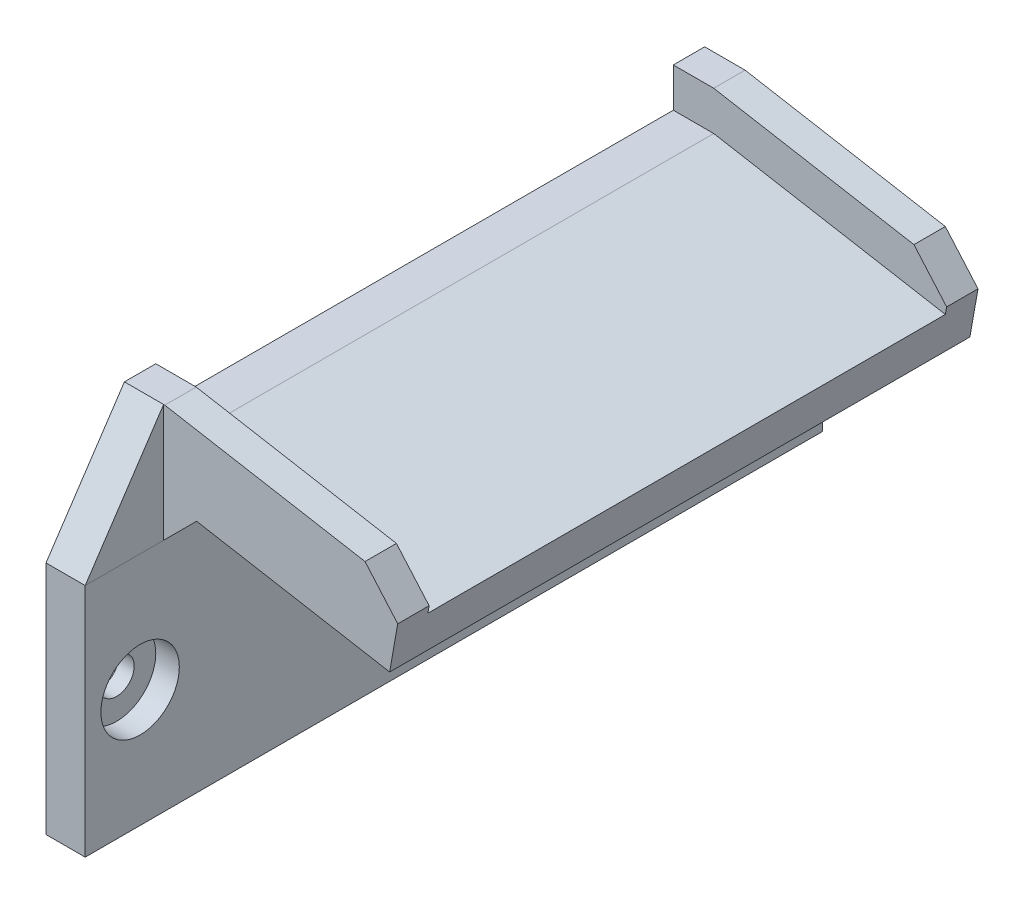
from build123d import *

# Parameters (mm, degrees)
ESTRUSIONE_ESTRUSIONE1_DEPTH                         = 66
ESTRUSIONE_ESTRUSIONE2_DEPTH                         = 4
ESTRUSIONE_ESTRUSIONE3_DEPTH                         = 4
ESTRUSIONE_ESTRUSIONE4_DEPTH                         = 10
ESTRUSIONE_ESTRUSIONE5_DEPTH                         = 10
FORO_LAMATO_PER_VITE_M4_A_TESTA_CILINDRI_D           = 4.5
FORO_LAMATO_PER_VITE_M4_A_TESTA_CILINDRI_DEPTH       = 45
FORO_LAMATO_PER_VITE_M4_A_TESTA_CILINDRI_CBORE_D     = 10
FORO_LAMATO_PER_VITE_M4_A_TESTA_CILINDRI_CBORE_DEPTH = 3
FORO_LAMATO_PER_VITE_M4_A_TESTA_CILINDRI_TIP         = 1.3519363928120107
ESTRUSIONE_ESTRUSIONE6_DEPTH                         = 5
ESTRUSIONE_ESTRUSIONE6_2_DEPTH                       = 5
SMUSSO2_SIZE                                         = 4
SMUSSO2_SIZE2                                        = 4.93958862614021
SMUSSO3_SIZE                                         = 4
SMUSSO3_SIZE2                                        = 4.939588626140206


with BuildPart() as part:
    # Schizzo1 → Estrusione-Estrusione1 (new body)
    with BuildSketch(Plane.XY):
        Polygon((0, 0), (0, 40), (5.15192246987794, 40), (34.69615506024418, 34.790554669992055), (33.82791417190951, 29.86651590493102), (9.207720346604313, 34.2077203466043), (4.9999999999999964, 30), (5, 0), align=None)
    extrude(amount=ESTRUSIONE_ESTRUSIONE1_DEPTH)

    # Schizzo3 → Estrusione-Estrusione2 (add)
    with BuildSketch(Plane.XY.offset(66)):
        Polygon((0, 40), (0, 0), (5, 0), (4.9999999999999964, 30), (9.207720346604313, 34.2077203466043), (33.82791417190951, 29.86651590493102), (34.69615506024418, 34.790554669992055), (5.15192246987794, 40), align=None)
        Polygon((-1.2e-16, 45), (-1.1e-16, 40), (5.15192246987794, 40), (34.69615506024418, 34.790554669992055), (35.55120541855835, 39.63978622195683), (5.15192246987794, 45), align=None)
    extrude(amount=ESTRUSIONE_ESTRUSIONE2_DEPTH)

    # Schizzo4 → Estrusione-Estrusione3 (add)
    with BuildSketch(Plane(origin=(0, 0, 0), x_dir=(-1, 0, 0), z_dir=(0, 0, -1))):
        Polygon((-5, 0), (0, 0), (1.2e-16, 45), (-5.15192246987794, 45), (-35.55120541855835, 39.63978622195684), (-33.82791417190951, 29.86651590493102), (-9.207720346604313, 34.2077203466043), (-4.9999999999999964, 30), align=None)
    extrude(amount=ESTRUSIONE_ESTRUSIONE3_DEPTH)

    # Schizzo5 → Estrusione-Estrusione4 (add)
    with BuildSketch(Plane(origin=(0, 0, -4), x_dir=(-1, 0, 0), z_dir=(0, 0, -1))):
        Polygon((-5, 0), (0, 0), (0, 30), (-4.9999999999999964, 30), align=None)
    extrude(amount=ESTRUSIONE_ESTRUSIONE4_DEPTH)

    # Schizzo6 → Estrusione-Estrusione5 (add)
    with BuildSketch(Plane.XY.offset(70)):
        Polygon((0, 0), (0, 30.000000000000004), (4.999999999999994, 30.000000000000004), (5, 0), align=None)
    extrude(amount=ESTRUSIONE_ESTRUSIONE5_DEPTH)

    # Foro lamato per Vite M4 a testa cilindrica piana-2
    with Locations(Plane(origin=(5, 5.8e-16, 0), x_dir=(0, 0, -1), z_dir=(1, 1.2e-16, 0))):
        with Locations((-73, 15), (7, 15)):
            CounterBoreHole(FORO_LAMATO_PER_VITE_M4_A_TESTA_CILINDRI_D / 2, FORO_LAMATO_PER_VITE_M4_A_TESTA_CILINDRI_CBORE_D / 2, FORO_LAMATO_PER_VITE_M4_A_TESTA_CILINDRI_CBORE_DEPTH, depth=FORO_LAMATO_PER_VITE_M4_A_TESTA_CILINDRI_DEPTH)
            with Locations((0, 0, -(FORO_LAMATO_PER_VITE_M4_A_TESTA_CILINDRI_DEPTH + FORO_LAMATO_PER_VITE_M4_A_TESTA_CILINDRI_TIP / 2))):  # 118° drill point
                Cone(0, FORO_LAMATO_PER_VITE_M4_A_TESTA_CILINDRI_D / 2, FORO_LAMATO_PER_VITE_M4_A_TESTA_CILINDRI_TIP, mode=Mode.SUBTRACT)

    # Smusso2
    smusso2_edges = [part.edges().sort_by_distance(p)[0] for p in [
        (35.55120541855835, 39.63978622195683, 68),
    ]]
    smusso2_side = [part.faces().sort_by_distance(p)[0] for p in [
        (34.344943382970804, 32.79873426983414, 33),
    ]]
    chamfer(smusso2_edges, length=SMUSSO2_SIZE, length2=SMUSSO2_SIZE2, reference=smusso2_side[0])

    # Smusso3
    smusso3_edges = [part.edges().sort_by_distance(p)[0] for p in [
        (35.55120541855835, 39.63978622195684, -2),
    ]]
    smusso3_side = [part.faces().sort_by_distance(p)[0] for p in [
        (34.310007644445946, 32.6006038510832, 31.57648462973645),
    ]]
    chamfer(smusso3_edges, length=SMUSSO3_SIZE, length2=SMUSSO3_SIZE2, reference=smusso3_side[0])


with BuildPart() as body_2:
    # Schizzo9 → Estrusione-Estrusione6 (new body)
    with BuildSketch(Plane.ZY):
        Polygon((-4, 45), (-14, 30), (-4, 29.999999999999993), align=None)
    extrude(amount=-ESTRUSIONE_ESTRUSIONE6_DEPTH)


with BuildPart() as body_3:
    # Schizzo9 → Estrusione-Estrusione6 2 (new body)
    with BuildSketch(Plane.ZY):
        Polygon((70, 45), (70, 30.000000000000004), (80, 30.000000000000004), align=None)
    extrude(amount=-ESTRUSIONE_ESTRUSIONE6_2_DEPTH)


solid = Compound([part.part, body_2.part, body_3.part])
